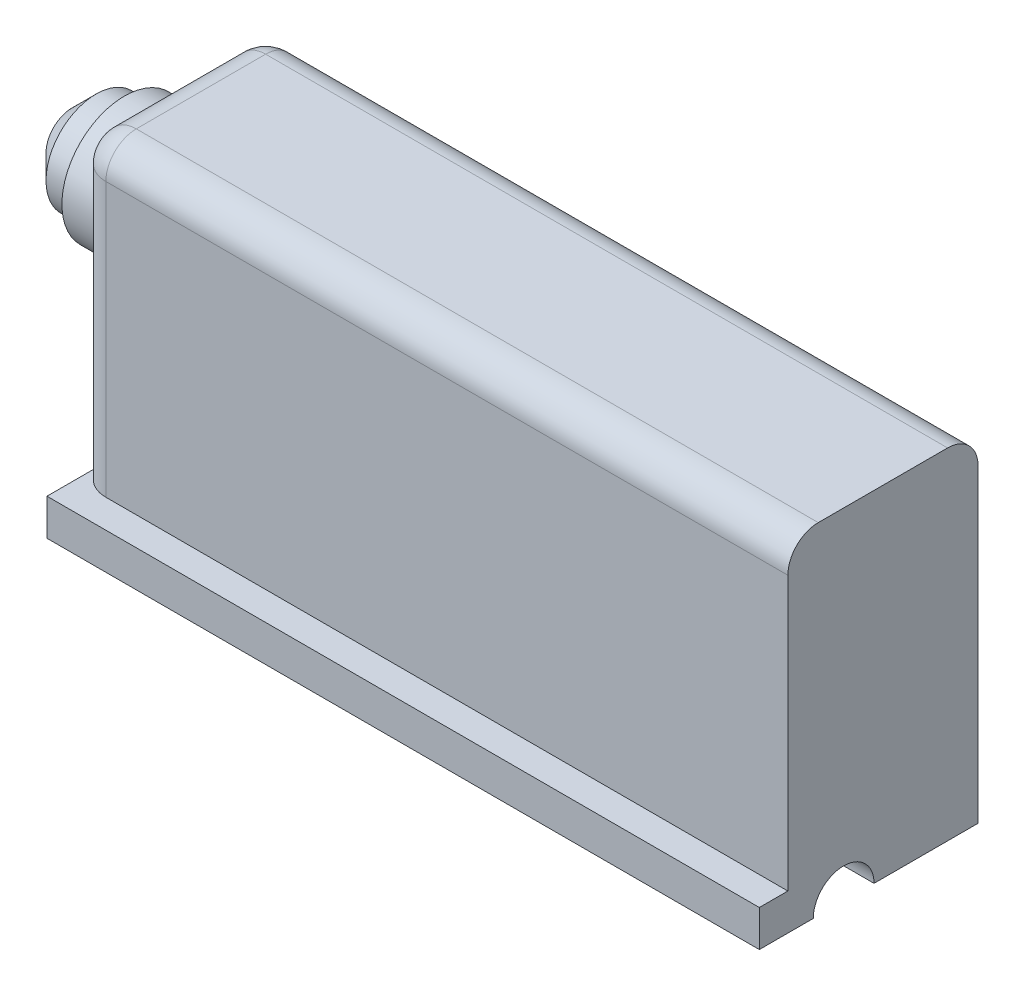
from build123d import *

# Parameters (mm, degrees)
SKETCH1_W           = 297.73626
SKETCH1_H           = 182.7784
BOSS_EXTRUDE1_DEPTH = 15.24
CUT_EXTRUDE1_DEPTH  = 350.695698609
SKETCH4_W           = 91.3892
SKETCH4_H           = 15.24
CUT_EXTRUDE3_DEPTH  = 350.695698609
SKETCH5_W           = 297.73626
SKETCH5_H           = 79.467279424
BOSS_EXTRUDE2_DEPTH = 127
FILLET1_R           = 12.7
FILLET2_R           = 12.7
FILLET3_R           = 12.7
SKETCH6_R           = 26.104541014
BOSS_EXTRUDE3_DEPTH = 19.304
SKETCH7_R           = 20.913687516
BOSS_EXTRUDE4_DEPTH = 21.844
CHAMFER1_SIZE       = 10
SKETCH8_R           = 4.376446561
CUT_EXTRUDE4_DEPTH  = 21.844


with BuildPart() as part:
    # Sketch1 → Boss-Extrude1 (new body)
    with BuildSketch(Plane(origin=(0, 0, 0), x_dir=(1, 0, 0), z_dir=(0, 1, 0))):
        with Locations((148.86813, 91.3892)):
            Rectangle(SKETCH1_W, SKETCH1_H)
    extrude(amount=BOSS_EXTRUDE1_DEPTH)

    # Sketch2 → Cut-Extrude1 (cut, through all)
    with BuildSketch(Plane.ZY):
        with BuildLine():
            ThreePointArc((-43.45432, 0), (-56.15432, 12.7), (-68.85432, 0))
            Line((-68.85432, 0), (-43.45432, 0))
        make_face()
        with BuildLine():
            ThreePointArc((-113.92408, 0), (-126.62408, 12.7), (-139.32408, 0))
            Line((-139.32408, 0), (-126.62408, 0))
            Line((-126.62408, 0), (-113.92408, 0))
        make_face()
    extrude(amount=-CUT_EXTRUDE1_DEPTH, mode=Mode.SUBTRACT)

    # Sketch4 → Cut-Extrude3 (cut, through all)
    with BuildSketch(Plane.ZY):
        with Locations((-45.6946, 7.62)):
            Rectangle(SKETCH4_W, SKETCH4_H)
    extrude(amount=-CUT_EXTRUDE3_DEPTH, mode=Mode.SUBTRACT)

    # Sketch5 → Boss-Extrude2 (add)
    with BuildSketch(Plane(origin=(0, 15.24, 0), x_dir=(1, 0, 0), z_dir=(0, 1, 0))):
        with Locations((148.86813, 143.044760288)):
            Rectangle(SKETCH5_W, SKETCH5_H)
    extrude(amount=BOSS_EXTRUDE2_DEPTH)

    # Fillet1
    fillet1_edges = [part.edges().sort_by_distance(p)[0] for p in [
        (148.86813, 142.24, -103.311120576),
    ]]
    fillet(fillet1_edges, radius=FILLET1_R)

    # Fillet2
    fillet2_edges = [part.edges().sort_by_distance(p)[0] for p in [
        (148.86813, 142.24, -182.7784),
    ]]
    fillet(fillet2_edges, radius=FILLET2_R)

    # Fillet3
    fillet3_edges = [part.edges().sort_by_distance(p)[0] for p in [
        (0, 72.39, -103.311120576),
        (0, 138.520256121, -107.030864455),
        (0, 64.77, -182.7784),
        (0, 142.24, -143.044760288),
        (0, 138.520256121, -179.058656121),
    ]]
    fillet(fillet3_edges, radius=FILLET3_R)

    # Sketch6 → Boss-Extrude3 (add)
    with BuildSketch(Plane.ZY):
        with Locations(Location((-143.044760288, 98.490679768, 0), (0, 0, 180))):
            Circle(SKETCH6_R)
    extrude(amount=BOSS_EXTRUDE3_DEPTH)

    # Sketch7 → Boss-Extrude4 (add)
    with BuildSketch(Plane.ZY.offset(19.304)):
        with Locations((-143.044760288, 98.490679768)):
            Circle(SKETCH7_R)
    extrude(amount=BOSS_EXTRUDE4_DEPTH)

    # Chamfer1
    chamfer1_edges = [part.edges().sort_by_distance(p)[0] for p in [
        (-41.148, 98.490679768, -163.958447804),
    ]]
    chamfer(chamfer1_edges, length=CHAMFER1_SIZE)

    # Sketch8 → Cut-Extrude4 (cut)
    with BuildSketch(Plane.ZY.offset(41.148)):
        with Locations((-143.044760288, 98.490679768)):
            Circle(SKETCH8_R)
        Polygon((-150.144784592, 100.727732071), (-152.082128716, 99.609205919), (-152.082128716, 97.372153616), (-150.144784592, 96.253627465), (-148.207440468, 97.372153616), (-148.207440468, 99.609205919), align=None)
    extrude(amount=-CUT_EXTRUDE4_DEPTH, mode=Mode.SUBTRACT)


solid = part.part
